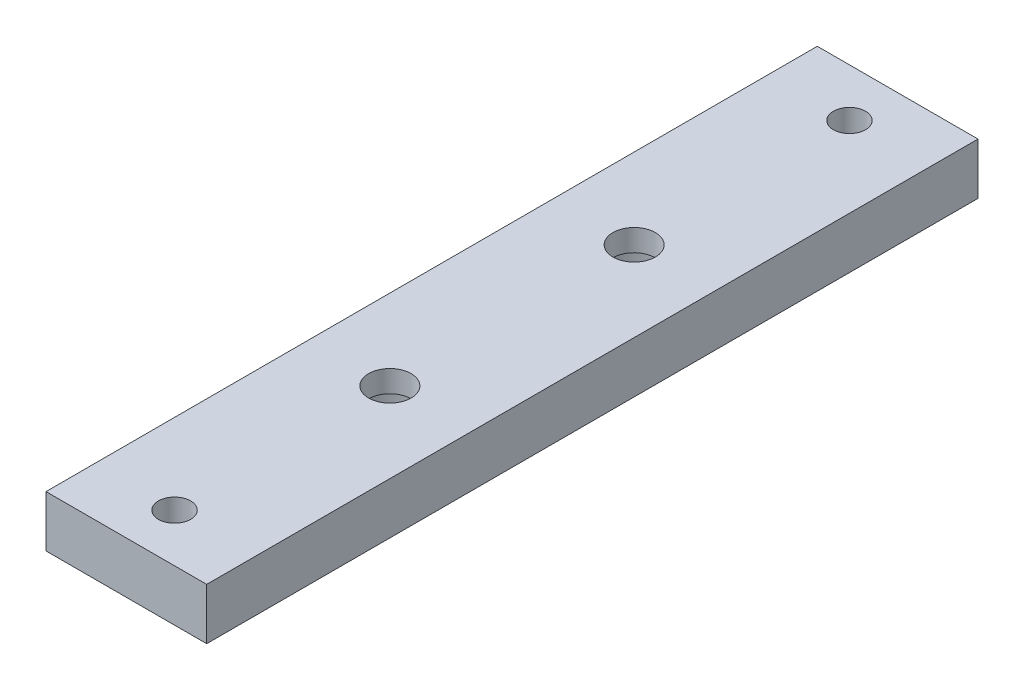
from build123d import *

# Parameters (mm, degrees)
SKICA1_W                                          = 25
SKICA1_H                                          = 120
P_IDAT_VYSUNUT_M1_DEPTH                           = 8
D_RY_PRO_KOL_K_VELIKOST_MM2_D                     = 5
D_RY_PRO_KOL_K_VELIKOST_MM2_DEPTH                 = 6
D_RY_PRO_KOL_K_VELIKOST_MM2_2_D                   = 4
D_RY_PRO_KOL_K_VELIKOST_MM2_2_DEPTH               = 1.7
V_LCOV_ZAHLOUBEN_PRO_M6_ROUBY_S_V_LCO_D           = 6.6
V_LCOV_ZAHLOUBEN_PRO_M6_ROUBY_S_V_LCO_CBORE_D     = 14
V_LCOV_ZAHLOUBEN_PRO_M6_ROUBY_S_V_LCO_CBORE_DEPTH = 4.6


with BuildPart() as part:
    # Skica1 → Přidat vysunutím1 (new body)
    with BuildSketch(Plane(origin=(0, 0, 0), x_dir=(1, 0, 0), z_dir=(0, 1, 0))):
        Rectangle(SKICA1_W, SKICA1_H)
    extrude(amount=P_IDAT_VYSUNUT_M1_DEPTH)

    # D_ry pro kol_k_ velikost mm2
    with Locations(Plane(origin=(0, 8, 0), x_dir=(1, 0, 0), z_dir=(0, 1, 0))):
        with Locations((0, -52.5), (0, 52.5)):
            Hole(D_RY_PRO_KOL_K_VELIKOST_MM2_D / 2, depth=D_RY_PRO_KOL_K_VELIKOST_MM2_DEPTH)

    # D_ry pro kol_k_ velikost mm2 2
    with Locations(Plane(origin=(0, 0, 0), x_dir=(-1, 0, 0), z_dir=(0, -1, 0))):
        with Locations((0, -52.5), (0, 52.5)):
            Hole(D_RY_PRO_KOL_K_VELIKOST_MM2_2_D / 2, depth=D_RY_PRO_KOL_K_VELIKOST_MM2_2_DEPTH)

    # Válcové zahloubení pro M6 šrouby s válcovou hlavou zaoblenou1 (through all)
    with Locations(Plane(origin=(0, 0, 0), x_dir=(-1, 0, 0), z_dir=(0, -1, 0))):
        with Locations((0, -19), (0, 19)):
            CounterBoreHole(V_LCOV_ZAHLOUBEN_PRO_M6_ROUBY_S_V_LCO_D / 2, V_LCOV_ZAHLOUBEN_PRO_M6_ROUBY_S_V_LCO_CBORE_D / 2, V_LCOV_ZAHLOUBEN_PRO_M6_ROUBY_S_V_LCO_CBORE_DEPTH)


solid = part.part
